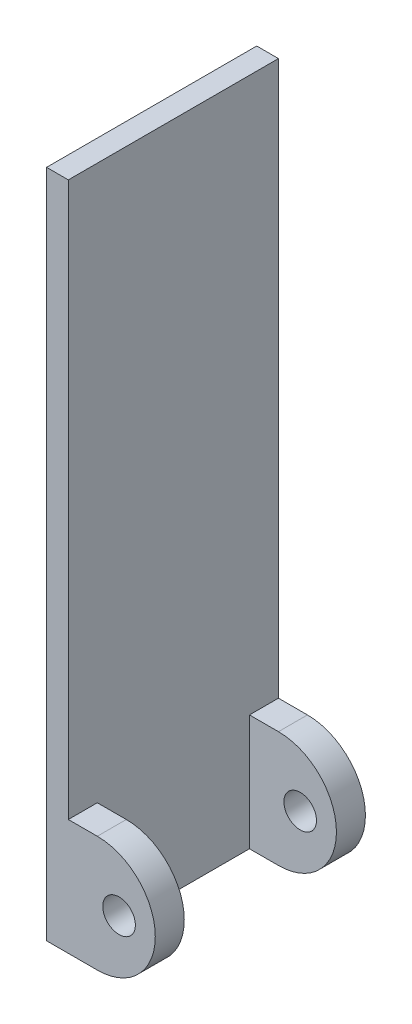
from build123d import *

# Parameters (mm, degrees)
SKETCH1_W                   = 3
SKETCH1_H                   = 92.446
BOSS_EXTRUDE1_DEPTH         = 29
SKETCH2_W                   = 12
SKETCH2_H                   = 16
SKETCH2_R                   = 2.25
BOSS_EXTRUDE2_DEPTH         = 4
FILLET2_RADIUS              = 8
FILLET2_LENGTH              = 4
FILLET2_OF_MIRROR2_2_RADIUS = 8
FILLET2_OF_MIRROR2_2_LENGTH = 4


with BuildPart() as part:
    # Sketch1 → Boss-Extrude1 (new body)
    with BuildSketch(Plane.XY):
        Rectangle(SKETCH1_W, SKETCH1_H)
    extrude(amount=BOSS_EXTRUDE1_DEPTH)

    # Sketch2 → Boss-Extrude2 (add)
    with BuildSketch(Plane.XY.offset(29)):
        with Locations((7.5, -38.223)):
            Rectangle(SKETCH2_W, SKETCH2_H)
        with Locations((8.5, -38.223)):
            Circle(SKETCH2_R, mode=Mode.SUBTRACT)
    boss_extrude2 = extrude(amount=-BOSS_EXTRUDE2_DEPTH)

    # Fillet2: full round fillet: the end face becomes a half cylinder, R = half its width
    fillet2_face = Plane((13.5, -38.223, 27), x_dir=(0, 0, -1), z_dir=(1, 0, 0))  # on the end face: x along it, z out of the body
    fillet2_slab = fillet2_face.offset(-FILLET2_RADIUS / 2) * Box(FILLET2_LENGTH, 2 * FILLET2_RADIUS, FILLET2_RADIUS, mode=Mode.PRIVATE)  # the body's end, R deep
    fillet2_round = Plane((5.5, -38.223, 27), x_dir=(1, 0, 0), z_dir=(0, 0, -1)) * Cylinder(FILLET2_RADIUS, FILLET2_LENGTH, mode=Mode.PRIVATE)  # its axis R under the face
    add(fillet2_slab - fillet2_round, mode=Mode.SUBTRACT)

    # Mirror2: Boss-Extrude2 across plane
    add(boss_extrude2.mirror(Plane.XY.offset(14.5)))

    # Fillet2 of Mirror2 2: full round fillet: the end face becomes a half cylinder, R = half its width
    fillet2_of_mirror2_2_face = Plane((13.5, -38.223, 2), x_dir=(0, 0, 1), z_dir=(1, 0, 0))  # on the end face: x along it, z out of the body
    fillet2_of_mirror2_2_slab = fillet2_of_mirror2_2_face.offset(-FILLET2_OF_MIRROR2_2_RADIUS / 2) * Box(FILLET2_OF_MIRROR2_2_LENGTH, 2 * FILLET2_OF_MIRROR2_2_RADIUS, FILLET2_OF_MIRROR2_2_RADIUS, mode=Mode.PRIVATE)  # the body's end, R deep
    fillet2_of_mirror2_2_round = Plane((5.5, -38.223, 2), x_dir=(1, 0, 0), z_dir=(0, 0, 1)) * Cylinder(FILLET2_OF_MIRROR2_2_RADIUS, FILLET2_OF_MIRROR2_2_LENGTH, mode=Mode.PRIVATE)  # its axis R under the face
    add(fillet2_of_mirror2_2_slab - fillet2_of_mirror2_2_round, mode=Mode.SUBTRACT)


solid = part.part
